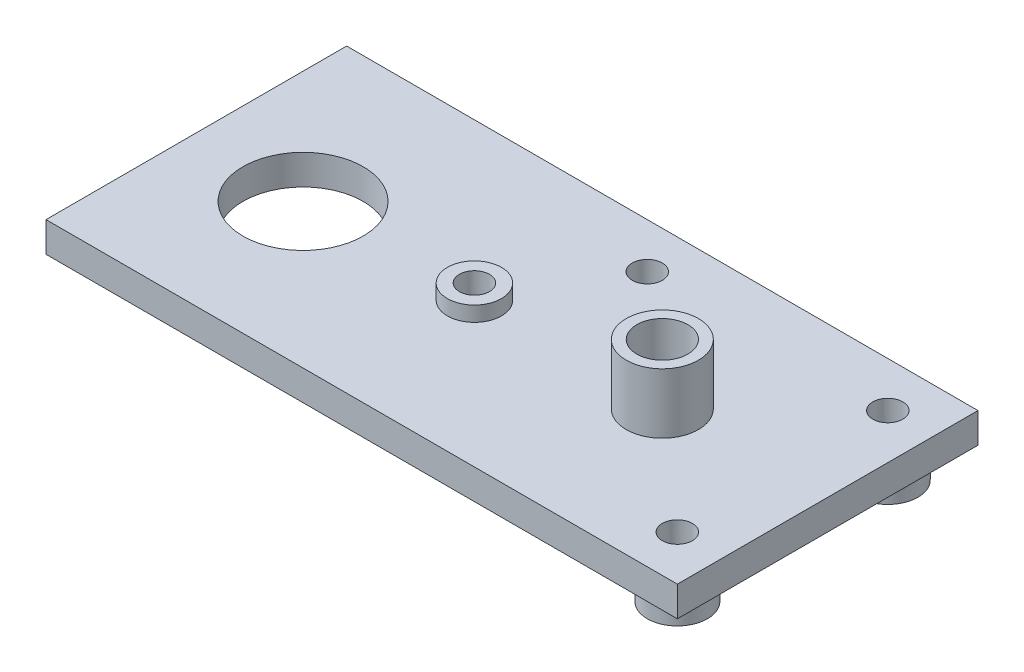
from build123d import *

# Parameters (mm, degrees)
SKETCH_1_W           = 21
SKETCH_1_H           = 10
EXTRUDE_1_DEPTH      = 1
SKETCH_2_R           = 1.2
EXTRUDE_2_DEPTH      = 2
SKETCH_3_R           = 0.85
CUT_EXTRUDE_2_DEPTH  = 3
EXTRUDE_3_DEPTH      = 0.5
EXTRUDE_3_DEPTH_BACK = 2
SKETCH_5_R           = 0.9
SKETCH_7_R           = 2
CUT_EXTRUDE_4_DEPTH  = 1
SKETCH_8_R           = 0.5
CUT_EXTRUDE_5_DEPTH  = 1
SKETCH_9_R           = 0.5
CUT_EXTRUDE_6_DEPTH  = 2
SKETCH_10_R          = 1
EXTRUDE_4_DEPTH      = 1
CUT_EXTRUDE_START    = -1
SKETCH_11_R          = 0.5
CUT_EXTRUDE_7_DEPTH  = 1


with BuildPart() as part:
    # 草图1 → 凸台-拉伸1 (new body)
    with BuildSketch(Plane(origin=(0, 0, 0), x_dir=(1, 0, 0), z_dir=(0, 1, 0))):
        Rectangle(SKETCH_1_W, SKETCH_1_H)
    extrude(amount=EXTRUDE_1_DEPTH)

    # 草图2 → 凸台-拉伸2 (add)
    with BuildSketch(Plane(origin=(0, 1, 0), x_dir=(1, 0, 0), z_dir=(0, 1, 0))):
        with Locations(Location((5.2, -0.2, 0), (0, 0, 270))):
            Circle(SKETCH_2_R)
    extrude(amount=EXTRUDE_2_DEPTH)

    # 草图3 → 切除-拉伸2 (cut)
    with BuildSketch(Plane(origin=(0, 3, 0), x_dir=(1, 0, 0), z_dir=(0, 1, 0))):
        with Locations(Location((5.2, -0.2, 0), (0, 0, 270))):
            Circle(SKETCH_3_R)
    extrude(amount=-CUT_EXTRUDE_2_DEPTH, mode=Mode.SUBTRACT)

    # 草图5 → 凸台-拉伸3 (add, two sides: drawn at the far end of the back side and taken through both)
    with BuildSketch(Plane(origin=(0, 1, 0), x_dir=(1, 0, 0), z_dir=(0, 1, 0)).offset(-EXTRUDE_3_DEPTH_BACK)):
        with Locations(Location((-1.05, -0.2, 0), (0, 0, 270))):
            Circle(SKETCH_5_R)
    extrude(amount=EXTRUDE_3_DEPTH + EXTRUDE_3_DEPTH_BACK)

    # 草图7 → 切除-拉伸4 (cut)
    with BuildSketch(Plane(origin=(0, 1, 0), x_dir=(1, 0, 0), z_dir=(0, 1, 0))):
        with Locations(Location((-6.75, -0.2, 0), (0, 0, 270))):
            Circle(SKETCH_7_R)
    extrude(amount=-CUT_EXTRUDE_4_DEPTH, mode=Mode.SUBTRACT)

    # 草图8 → 切除-拉伸5 (cut)
    with BuildSketch(Plane(origin=(0, 1, 0), x_dir=(1, 0, 0), z_dir=(0, 1, 0))):
        with Locations(Location((9, 3.5, 0), (0, 0, 270))):
            Circle(SKETCH_8_R)
        with Locations(Location((1, 3.5, 0), (0, 0, 270))):
            Circle(SKETCH_8_R)
        with Locations(Location((9, -3.5, 0), (0, 0, 270))):
            Circle(SKETCH_8_R)
    extrude(amount=-CUT_EXTRUDE_5_DEPTH, mode=Mode.SUBTRACT)

    # 草图9 → 切除-拉伸6 (cut)
    with BuildSketch(Plane(origin=(0, 1.5, 0), x_dir=(1, 0, 0), z_dir=(0, 1, 0))):
        with Locations(Location((-1.05, -0.2, 0), (0, 0, 270))):
            Circle(SKETCH_9_R)
    extrude(amount=-CUT_EXTRUDE_6_DEPTH, mode=Mode.SUBTRACT)

    # 草图10 → 凸台-拉伸4 (add)
    with BuildSketch(Plane.XZ):
        with Locations(Location((9, 3.5, 0), (0, 0, 90))):
            Circle(SKETCH_10_R)
        with Locations(Location((9, -3.5, 0), (0, 0, 90))):
            Circle(SKETCH_10_R)
        with Locations(Location((1, -3.5, 0), (0, 0, 90))):
            Circle(SKETCH_10_R)
    extrude(amount=EXTRUDE_4_DEPTH)

    # 草图11 → 切除-拉伸7 (cut)
    with BuildSketch(Plane.XZ.offset(1).offset(CUT_EXTRUDE_START)):
        with Locations(Location((9, 3.5, 0), (0, 0, 90))):
            Circle(SKETCH_11_R)
        with Locations(Location((9, -3.5, 0), (0, 0, 90))):
            Circle(SKETCH_11_R)
        with Locations(Location((1, -3.5, 0), (0, 0, 90))):
            Circle(SKETCH_11_R)
    extrude(amount=CUT_EXTRUDE_7_DEPTH, mode=Mode.SUBTRACT)


solid = part.part
